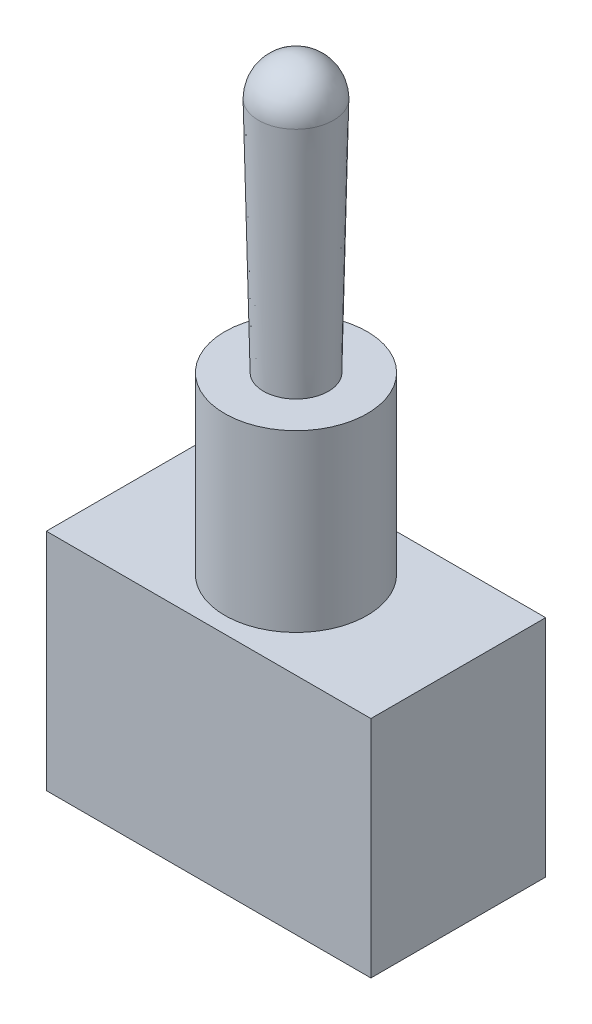
from build123d import *

# Parameters (mm, degrees)
SKETCH_1_W      = 13
SKETCH_1_H      = 9
EXTRUDE_1_DEPTH = 7
SKETCH_2_R      = 2.85
EXTRUDE_2_DEPTH = 7


with BuildPart() as part:
    # 草图1 → 凸台-拉伸1 (new body)
    with BuildSketch(Plane.XY):
        Rectangle(SKETCH_1_W, SKETCH_1_H)
    extrude(amount=EXTRUDE_1_DEPTH)

    # 草图2 → 凸台-拉伸2 (add)
    with BuildSketch(Plane(origin=(0, 4.5, 0), x_dir=(1, 0, 0), z_dir=(0, 1, 0))):
        with Locations(Location((0, -3.5, 0), (0, 0, 180))):
            Circle(SKETCH_2_R)
    extrude(amount=EXTRUDE_2_DEPTH)

    # 草图3 → 旋转1 (revolve)
    with BuildSketch(Plane(origin=(0, 0, 0), x_dir=(0, 0, -1), z_dir=(1, 0, 0)), mode=Mode.PRIVATE) as revolve_1_sk:
        with BuildLine():
            Line((-3.5, 11.5), (-4.8, 11.5))
            Line((-4.8, 11.5), (-5, 21))
            ThreePointArc((-5, 21), (-4.560660172, 22.060660172), (-3.5, 22.5))
            Line((-3.5, 22.5), (-3.5, 11.5))
        make_face()
    revolve(revolve_1_sk.sketch.rotate(Axis((0, 11.5, 3.5), (0, 1, 0)), 180), axis=Axis((0, 11.5, 3.5), (0, 1, 0)))


solid = part.part
